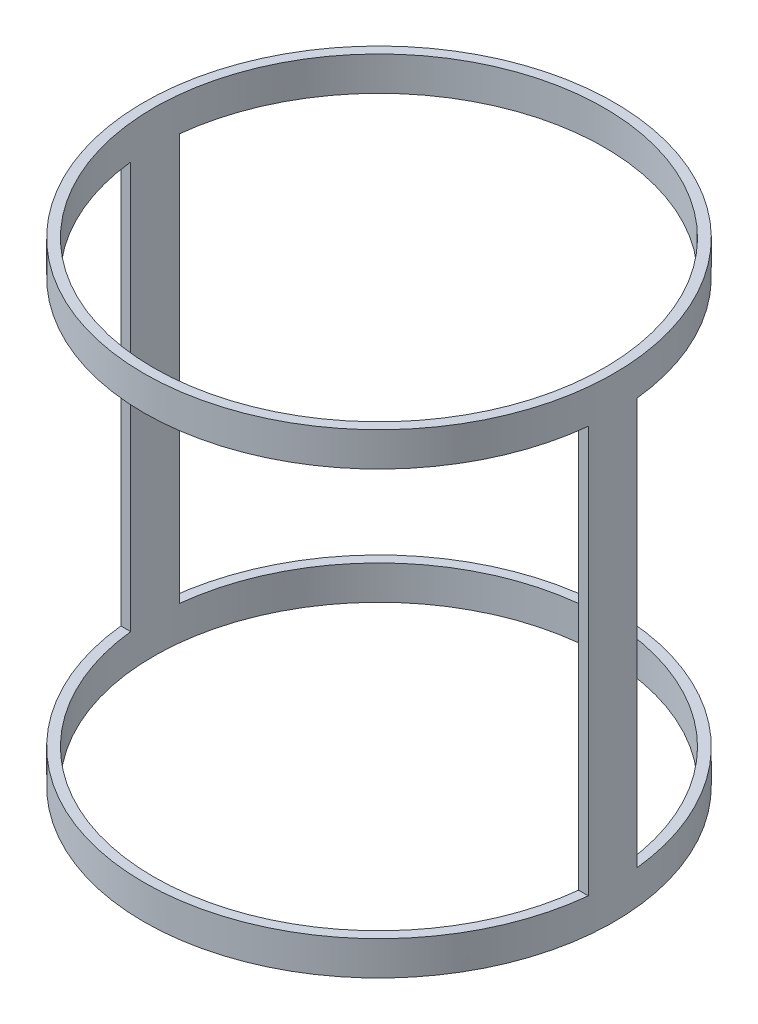
from build123d import *

# Parameters (mm, degrees)
BOSS_EXTRUDE1_DEPTH   = 97.5
BOSS_EXTRUDE1_2_DEPTH = 97.5
SKETCH2_R             = 48.25
SKETCH2_R_2           = 46.25
BOSS_EXTRUDE2_DEPTH   = 7
BOSS_EXTRUDE3_START   = -7
SKETCH3_R             = 48.25
SKETCH3_R_2           = 46.25
BOSS_EXTRUDE3_DEPTH   = 7


with BuildPart() as part:
    # Sketch1 → Boss-Extrude1 (new body)
    with BuildSketch(Plane(origin=(0, 0, 0), x_dir=(1, 0, 0), z_dir=(0, 1, 0))):
        with BuildLine():
            Line((-47.990233381, 5), (-45.978935394, 5))
            ThreePointArc((-45.978935394, 5), (-46.25, 0), (-45.978935394, -5))
            Line((-45.978935394, -5), (-47.990233381, -5))
            ThreePointArc((-47.990233381, -5), (-48.25, 0), (-47.990233381, 5))
        make_face()
    extrude(amount=BOSS_EXTRUDE1_DEPTH)



with BuildPart() as body_2:
    # Sketch1 → Boss-Extrude1 2 (new body)
    with BuildSketch(Plane(origin=(0, 0, 0), x_dir=(1, 0, 0), z_dir=(0, 1, 0))):
        with BuildLine():
            Line((47.990233381, -5), (45.978935394, -5))
            ThreePointArc((45.978935394, -5), (46.25, 0), (45.978935394, 5))
            Line((45.978935394, 5), (47.990233381, 5))
            ThreePointArc((47.990233381, 5), (48.25, 0), (47.990233381, -5))
        make_face()
    extrude(amount=BOSS_EXTRUDE1_2_DEPTH)


with BuildPart() as part_1:
    add(part.part)

    add(body_2.part)  # Boss-Extrude2 merges body 2
    # Sketch2 → Boss-Extrude2 (add)
    with BuildSketch(Plane(origin=(0, 0, 0), x_dir=(1, 0, 0), z_dir=(0, 1, 0))):
        with Locations(Location((0, 0, 0), (0, 0, 5.94806464))):
            Circle(SKETCH2_R)
        with Locations(Location((0, 0, 0), (0, 0, 173.793732249))):
            Circle(SKETCH2_R_2, mode=Mode.SUBTRACT)
    extrude(amount=BOSS_EXTRUDE2_DEPTH)

    # Sketch3 → Boss-Extrude3 (add)
    with BuildSketch(Plane(origin=(0, 97.5, 0), x_dir=(1, 0, 0), z_dir=(0, 1, 0)).offset(BOSS_EXTRUDE3_START)):
        with Locations(Location((0, 0, 0), (0, 0, 270))):
            Circle(SKETCH3_R)
        with Locations(Location((0, 0, 0), (0, 0, 270))):
            Circle(SKETCH3_R_2, mode=Mode.SUBTRACT)
    extrude(amount=BOSS_EXTRUDE3_DEPTH)


solid = part_1.part
